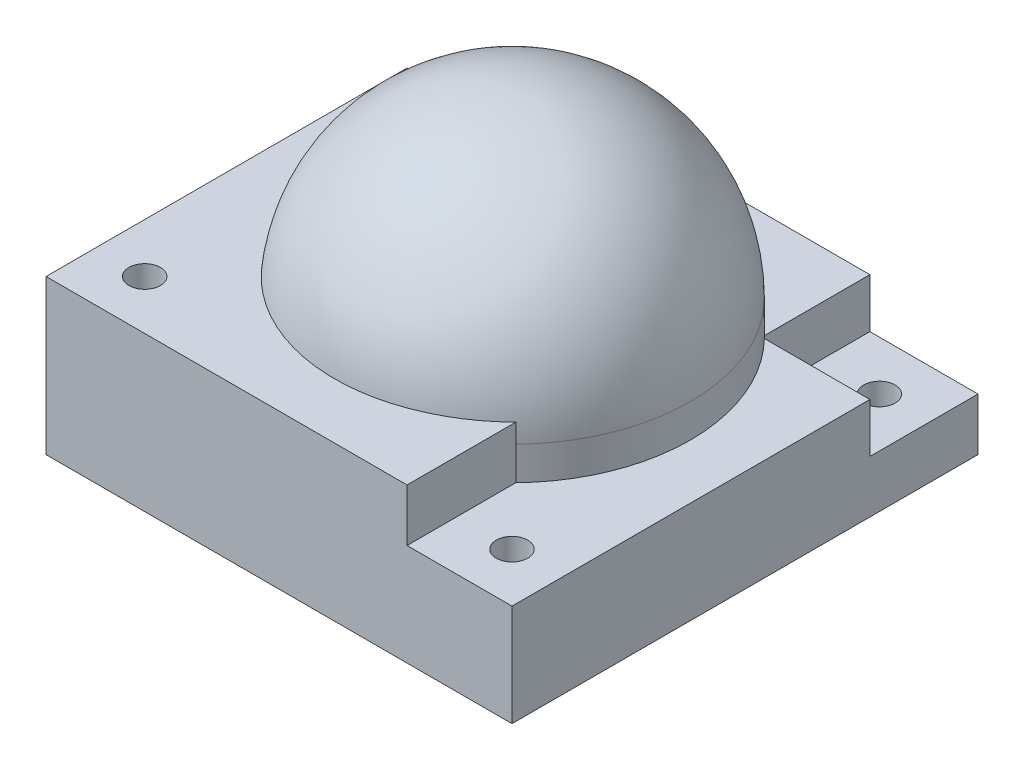
from build123d import *

# Parameters (mm, degrees)
SKETCH3_W               = 44.4
SKETCH3_H               = 44.4
BOSS_EXTRUDE1_DEPTH     = 9.7
SKETCH5_R               = 6
CUT_EXTRUDE2_DEPTH      = 14.3
BOSS_EXTRUDE2_DEPTH     = 5
CUT_EXTRUDE3_DEPTH      = 35.870626966
CUT_EXTRUDE3_DEPTH_BACK = 35.870626966
SKETCH7_R               = 1.5
SKETCH8_W               = 10.3
SKETCH8_H               = 10.3
CUT_EXTRUDE4_DEPTH      = 4.7


with BuildPart() as part:
    # Sketch2 → Revolve1 (revolve)
    with BuildSketch(Plane.XY, mode=Mode.PRIVATE) as revolve1_sk:
        with BuildLine():
            Line((-10, 0), (-12, 0))
            ThreePointArc((-12, 0), (-8.485281374, 8.485281374), (0, 12))
            Line((0, 12), (0, 17))
            ThreePointArc((0, 17), (-12.02081528, 12.02081528), (-17, 0))
            Line((-17, 0), (-17, -3.175))
            Line((-17, -3.175), (-10, -3.175))
            Line((-10, -3.175), (-10, 0))
        make_face()
    revolve(revolve1_sk.sketch.rotate(Axis((0, 12, 0), (0, 1, 0)), 180), axis=Axis((0, 12, 0), (0, 1, 0)))

    # Sketch3 → Boss-Extrude1 (add)
    with BuildSketch(Plane.XZ.offset(3.175)):
        Rectangle(SKETCH3_W, SKETCH3_H)
    extrude(amount=BOSS_EXTRUDE1_DEPTH)

    # Sketch5 → Cut-Extrude2 (cut)
    with BuildSketch(Plane.XZ.offset(12.875)):
        Circle(SKETCH5_R)
    extrude(amount=-CUT_EXTRUDE2_DEPTH, mode=Mode.SUBTRACT)

    # Sketch6 → Boss-Extrude2 (add)
    with BuildSketch(Plane(origin=(0, -3.175, 0), x_dir=(1, 0, 0), z_dir=(0, 1, 0))):
        with BuildLine():
            Line((-22.2, -22.2), (-22.2, 12.2))
            Line((-22.2, 12.2), (-11.83, 12.2))
            ThreePointArc((-11.83, 12.2), (-11.83, -11.83), (12.2, -11.83))
            Line((12.2, -11.83), (12.2, -22.2))
            Line((12.2, -22.2), (-22.2, -22.2))
        make_face()
    extrude(amount=BOSS_EXTRUDE2_DEPTH)

    # Sketch7 → Cut-Extrude3 (cut, two sides: drawn at the far end of the back side and taken through both)
    with BuildSketch(Plane(origin=(0, 1.825, 0), x_dir=(1, 0, 0), z_dir=(0, 1, 0)).offset(-CUT_EXTRUDE3_DEPTH_BACK)):
        with Locations(Location((-17.5, -17.5, 0), (0, 0, 180))):
            Circle(SKETCH7_R)
        with Locations(Location((17.5, -17.5, 0), (0, 0, 180))):
            Circle(SKETCH7_R)
        with Locations(Location((17.5, 17.5, 0), (0, 0, 180))):
            Circle(SKETCH7_R)
        with Locations(Location((-17.5, 17.5, 0), (0, 0, 180))):
            Circle(SKETCH7_R)
    extrude(amount=CUT_EXTRUDE3_DEPTH + CUT_EXTRUDE3_DEPTH_BACK, mode=Mode.SUBTRACT)

    # Sketch8 → Cut-Extrude4 (cut)
    with BuildSketch(Plane(origin=(0, -3.175, 0), x_dir=(1, 0, 0), z_dir=(0, 1, 0))):
        with Locations((17.05, 17.05)):
            Rectangle(SKETCH8_W, SKETCH8_H)
    extrude(amount=-CUT_EXTRUDE4_DEPTH, mode=Mode.SUBTRACT)


solid = part.part
